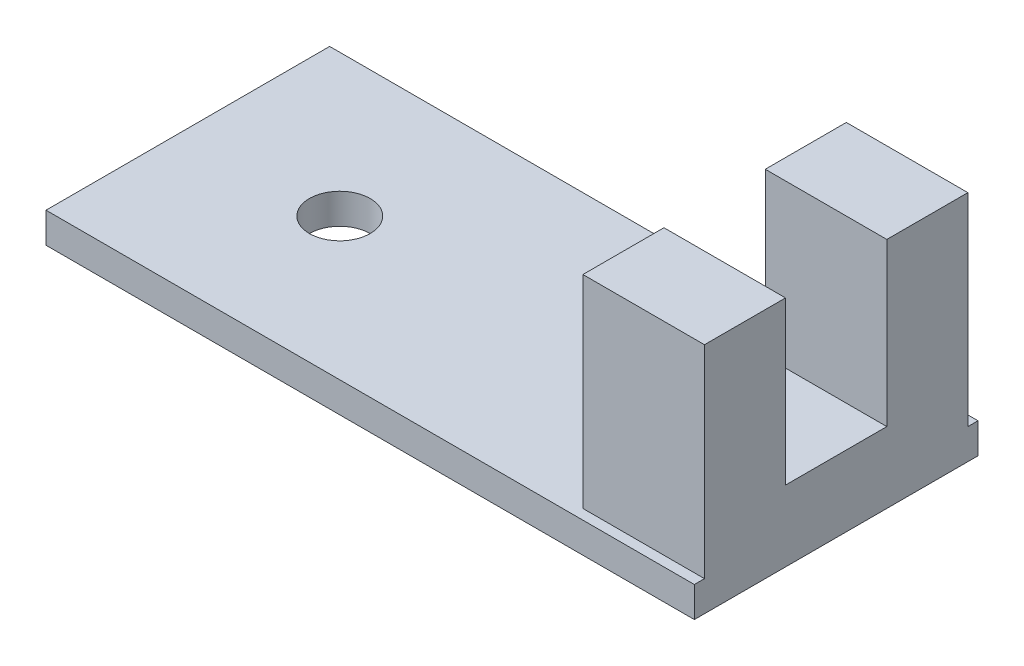
from build123d import *

# Parameters (mm, degrees)
SKETCH1_W           = 32
SKETCH1_H           = 14
SKETCH1_R           = 1.5
BOSS_EXTRUDE1_DEPTH = 1.5
SKETCH2_W           = 6
SKETCH2_H           = 13
BOSS_EXTRUDE2_DEPTH = 2
SKETCH3_W           = 6
SKETCH3_H           = 4
BOSS_EXTRUDE3_DEPTH = 8


with BuildPart() as part:
    # Sketch1 → Boss-Extrude1 (new body)
    with BuildSketch(Plane(origin=(0, 0, 0), x_dir=(1, 0, 0), z_dir=(0, 1, 0))):
        Rectangle(SKETCH1_W, SKETCH1_H)
        with Locations(Location((-8.5, 0, 0), (0, 0, 270))):
            Circle(SKETCH1_R, mode=Mode.SUBTRACT)
    extrude(amount=BOSS_EXTRUDE1_DEPTH)

    # Sketch2 → Boss-Extrude2 (add)
    with BuildSketch(Plane(origin=(0, 1.5, 0), x_dir=(1, 0, 0), z_dir=(0, 1, 0))):
        with Locations((13, 0)):
            Rectangle(SKETCH2_W, SKETCH2_H)
    extrude(amount=BOSS_EXTRUDE2_DEPTH)

    # Sketch3 → Boss-Extrude3 (add)
    with BuildSketch(Plane(origin=(0, 3.5, 0), x_dir=(1, 0, 0), z_dir=(0, 1, 0))):
        with Locations((13, 4.5)):
            Rectangle(SKETCH3_W, SKETCH3_H)
        with Locations((13, -4.5)):
            Rectangle(SKETCH3_W, SKETCH3_H)
    extrude(amount=BOSS_EXTRUDE3_DEPTH)


solid = part.part
